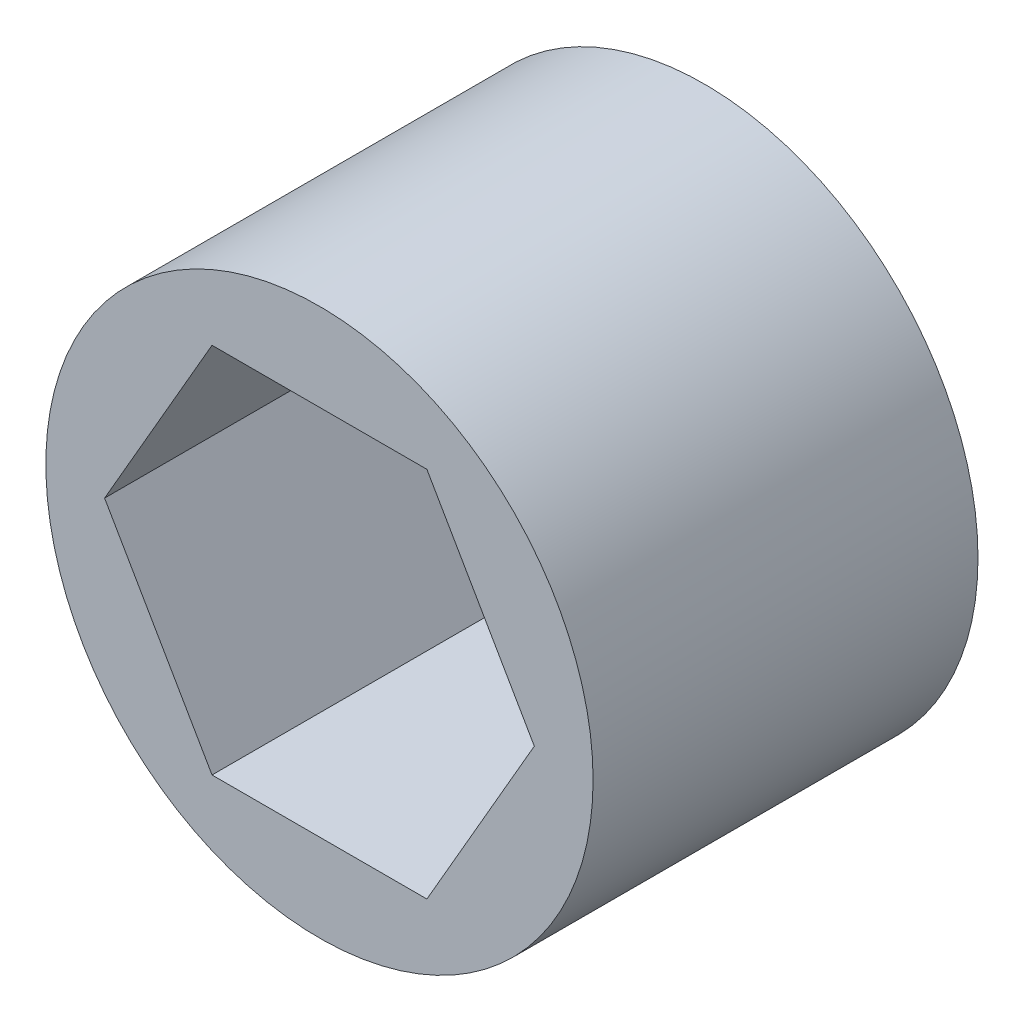
from build123d import *

# Parameters (mm, degrees)
SKETCH1_R           = 9.525
BOSS_EXTRUDE1_DEPTH = 6.69925


with BuildPart() as part:
    # Sketch1 → Boss-Extrude1 (new, symmetric)
    with BuildSketch(Plane.XY):
        Circle(SKETCH1_R)
        Polygon((7.478995387, 0), (3.739497694, 6.477), (-3.739497694, 6.477), (-7.478995387, 0), (-3.739497694, -6.477), (3.739497694, -6.477), align=None, mode=Mode.SUBTRACT)
    extrude(amount=BOSS_EXTRUDE1_DEPTH, both=True)


solid = part.part
